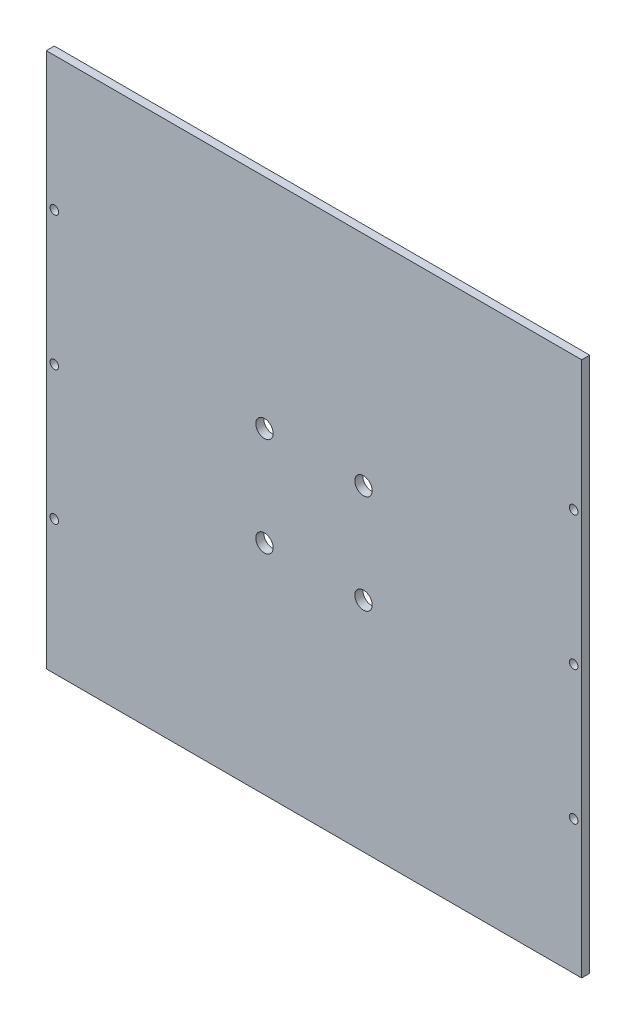
from build123d import *

# Parameters (mm, degrees)
SKETCH_1_W      = 200
SKETCH_1_H      = 200
SKETCH_1_R      = 3.25
SKETCH_1_R_2    = 1.6
EXTRUDE_1_DEPTH = 3


with BuildPart() as part:
    # 草图1 → 凸台-拉伸1 (new body)
    with BuildSketch(Plane.XY):
        Rectangle(SKETCH_1_W, SKETCH_1_H)
        with Locations((-18.5, 18.5)):
            Circle(SKETCH_1_R, mode=Mode.SUBTRACT)
        with Locations(Location((18.5, 18.5, 0), (0, 0, 180))):
            Circle(SKETCH_1_R, mode=Mode.SUBTRACT)
        with Locations((18.5, -18.5)):
            Circle(SKETCH_1_R, mode=Mode.SUBTRACT)
        with Locations(Location((-18.5, -18.5, 0), (0, 0, 180))):
            Circle(SKETCH_1_R, mode=Mode.SUBTRACT)
        with Locations((97, -50)):
            Circle(SKETCH_1_R_2, mode=Mode.SUBTRACT)
        with Locations(Location((97, 50, 0), (0, 0, 180))):
            Circle(SKETCH_1_R_2, mode=Mode.SUBTRACT)
        with Locations(Location((-97, -50, 0), (0, 0, 180))):
            Circle(SKETCH_1_R_2, mode=Mode.SUBTRACT)
        with Locations((-97, 50)):
            Circle(SKETCH_1_R_2, mode=Mode.SUBTRACT)
        with Locations((-97, 0)):
            Circle(SKETCH_1_R_2, mode=Mode.SUBTRACT)
        with Locations((97, 0)):
            Circle(SKETCH_1_R_2, mode=Mode.SUBTRACT)
    extrude(amount=EXTRUDE_1_DEPTH)


solid = part.part
